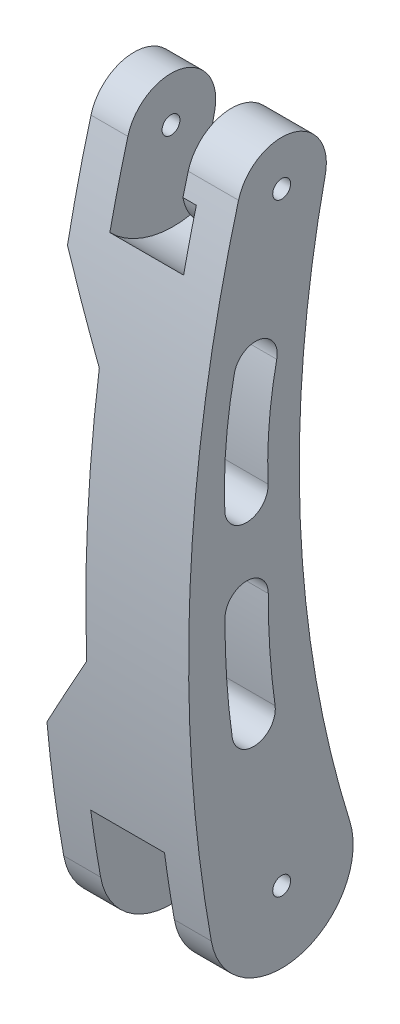
from build123d import *

# Parameters (mm, degrees)
SKETCH1_R               = 2
BOSS_EXTRUDE1_DEPTH     = 33
CUT_EXTRUDE1_DEPTH      = 13.5
CUT_EXTRUDE2_DEPTH      = 16.5
SKETCH4_R               = 2
CUT_EXTRUDE3_DEPTH      = 5
CUT_EXTRUDE4_DEPTH      = 3
CUT_EXTRUDE5_DEPTH      = 151.15655797
CUT_EXTRUDE5_DEPTH_BACK = 151.15655797


with BuildPart() as part:
    # Sketch1 → Boss-Extrude1 (new body)
    with BuildSketch(Plane(origin=(0, 0, 0), x_dir=(0, 0, -1), z_dir=(1, 0, 0))):
        with BuildLine():
            ThreePointArc((-15.746923292, -2.834502924), (3.806207647, -15.54068156), (15.274538651, 4.763241437))
            ThreePointArc((15.274538651, 4.763241437), (4.169990688, 68.449264041), (9.766892503, 132.853418803))
            ThreePointArc((9.766892503, 132.853418803), (2.382772527, 144.71197174), (-9.651340082, 137.617562724))
            ThreePointArc((-9.651340082, 137.617562724), (-20.507516508, 67.730411775), (-15.746923292, -2.834502924))
        make_face()
        with Locations((0, 135)):
            Circle(SKETCH1_R, mode=Mode.SUBTRACT)
        Circle(SKETCH1_R, mode=Mode.SUBTRACT)
        with BuildLine():
            ThreePointArc((-12.675406771, 58.150621112), (-12.300365948, 46.179147672), (-11.058070356, 34.266400985))
            ThreePointArc((-11.058070356, 34.266400985), (-5.587650283, 30.149080215), (-1.470329513, 35.619500288))
            ThreePointArc((-1.470329513, 35.619500288), (-2.639739364, 46.833323654), (-2.992776465, 58.102428263))
            ThreePointArc((-2.992776465, 58.102428263), (-7.809995194, 62.967839841), (-12.675406771, 58.150621112))
        make_face(mode=Mode.SUBTRACT)
        with BuildLine():
            ThreePointArc((-10.574940666, 104.538451831), (-12.44695641, 91.799336957), (-12.717862815, 78.926260385))
            ThreePointArc((-12.717862815, 78.926260385), (-7.68030208, 74.289364014), (-3.04340571, 79.326924749))
            ThreePointArc((-3.04340571, 79.326924749), (-2.79792055, 90.992020929), (-1.101570529, 102.535726074))
            ThreePointArc((-1.101570529, 102.535726074), (-4.836892719, 108.273774021), (-10.574940666, 104.538451831))
        make_face(mode=Mode.SUBTRACT)
    extrude(amount=BOSS_EXTRUDE1_DEPTH)

    # Sketch2 → Cut-Extrude1 (cut)
    with BuildSketch(Plane.ZY.offset(-8.25)):
        with BuildLine():
            ThreePointArc((9.651340082, 137.617562724), (-2.382772527, 144.71197174), (-9.766892503, 132.853418803))
            ThreePointArc((-9.766892503, 132.853418803), (-8.074404211, 124.471332441), (-6.669573364, 116.036266424))
            ThreePointArc((-6.669573364, 116.036266424), (4.209591857, 115.639688485), (13.684813674, 121.000069207))
            ThreePointArc((13.684813674, 121.000069207), (11.779096359, 129.335763119), (9.651340082, 137.617562724))
        make_face()
    extrude(amount=-CUT_EXTRUDE1_DEPTH, mode=Mode.SUBTRACT)

    # Sketch3 → Cut-Extrude2 (cut)
    with BuildSketch(Plane.ZY.offset(-8.25)):
        with BuildLine():
            ThreePointArc((15.746923292, -2.834502924), (16.932948663, 4.203707123), (17.961705011, 11.266618507))
            ThreePointArc((17.961705011, 11.266618507), (4.818924594, 21.467521501), (-11.493429399, 18.196710256))
            ThreePointArc((-11.493429399, 18.196710256), (-13.290230642, 11.453587146), (-15.274538651, 4.763241437))
            ThreePointArc((-15.274538651, 4.763241437), (-3.806207647, -15.54068156), (15.746923292, -2.834502924))
        make_face()
    extrude(amount=-CUT_EXTRUDE2_DEPTH, mode=Mode.SUBTRACT)

    # Sketch4 → Cut-Extrude3 (cut)
    with BuildSketch(Plane.ZY):
        with BuildLine():
            Line((5.508484382, 3.419742698), (6.214100211, 16.883694767))
            ThreePointArc((6.214100211, 16.883694767), (4.158233816, 19.562952015), (1.190354311, 17.951524922))
            Line((1.190354311, 17.951524922), (-3.641316221, 5.364592854))
            ThreePointArc((-3.641316221, 5.364592854), (-3.710000961, 5.241267271), (-3.810417562, 5.14205387))
            ThreePointArc((-3.810417562, 5.14205387), (-1.330634821, -6.260144645), (5.572451385, 3.147663508))
            ThreePointArc((5.572451385, 3.147663508), (5.521069981, 3.279142571), (5.508484382, 3.419742698))
        make_face()
        Circle(SKETCH4_R, mode=Mode.SUBTRACT)
    extrude(amount=-CUT_EXTRUDE3_DEPTH, mode=Mode.SUBTRACT)

    # Sketch6 → Cut-Extrude4 (cut)
    with BuildSketch(Plane.ZY.offset(-21.75)):
        with BuildLine():
            ThreePointArc((-6.669573364, 116.036266424), (-7.677372534, 122.259874843), (-8.841790135, 128.456090831))
            ThreePointArc((-8.841790135, 128.456090831), (2.534260756, 124.295910948), (10.837329247, 133.115246758))
            ThreePointArc((10.837329247, 133.115246758), (12.319974341, 127.07150219), (13.684813674, 121.000069207))
            ThreePointArc((13.684813674, 121.000069207), (4.209591857, 115.639688485), (-6.669573364, 116.036266424))
        make_face()
    extrude(amount=-CUT_EXTRUDE4_DEPTH, mode=Mode.SUBTRACT)

    # Sketch8 → Cut-Extrude5 (cut, two sides: drawn at the far end of the back side and taken through both)
    with BuildSketch(Plane.XY.offset(-CUT_EXTRUDE5_DEPTH_BACK)):
        Polygon((0, 115.000069207), (0, 25), (10, 42.320508076), (10, 97.679561131), align=None)
    extrude(amount=CUT_EXTRUDE5_DEPTH + CUT_EXTRUDE5_DEPTH_BACK, mode=Mode.SUBTRACT)


solid = part.part
